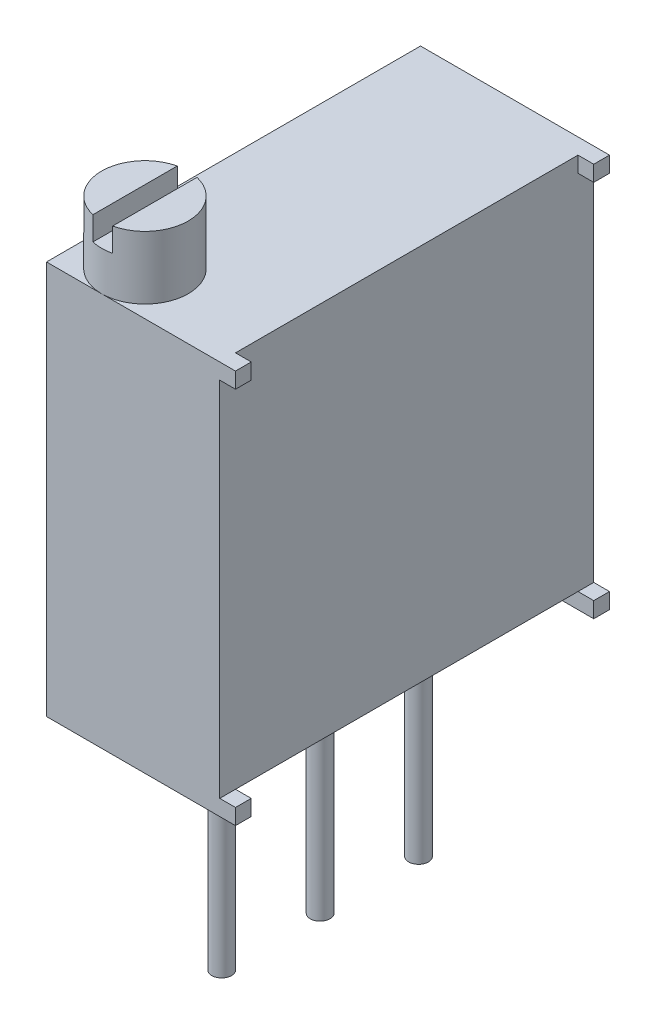
from build123d import *

# Parameters (mm, degrees)
EXTRUDE_1_DEPTH     = 4.4
SKETCH_1_4_W        = 0.4
SKETCH_1_4_H        = 0.4
EXTRUDE_2_DEPTH     = 4.8
SKETCH_2_R          = 1.1
EXTRUDE_3_DEPTH     = 1.6
CUT_EXTRUDE_START   = 1.6
SKETCH_2_5_W        = 0.5
SKETCH_2_5_H        = 2.2
CUT_EXTRUDE_2_DEPTH = 0.6
SKETCH_3_R          = 0.25
EXTRUDE_4_DEPTH     = 6


with BuildPart() as part:
    # 草图1 → 凸台-拉伸1 (new body)
    with BuildSketch(Plane(origin=(0, 0, 0), x_dir=(0, 0, -1), z_dir=(1, 0, 0))):
        Polygon((-4.75, 4.4), (-4.75, -4.8), (-4.35, -4.8), (4.35, -4.8), (4.75, -4.8), (4.75, 4.4), (4.35, 4.4), (4.35, 4.8), (-4.35, 4.8), (-4.35, 4.4), align=None)
    extrude(amount=EXTRUDE_1_DEPTH)

    # 草图1<4> → 凸台-拉伸2 (add)
    with BuildSketch(Plane(origin=(0, 0, 0), x_dir=(0, 0, -1), z_dir=(1, 0, 0))):
        with Locations((4.55, 4.6)):
            Rectangle(SKETCH_1_4_W, SKETCH_1_4_H)
        with Locations((4.55, -5)):
            Rectangle(SKETCH_1_4_W, SKETCH_1_4_H)
        with Locations((-4.55, 4.6)):
            Rectangle(SKETCH_1_4_W, SKETCH_1_4_H)
        with Locations((-4.55, -5)):
            Rectangle(SKETCH_1_4_W, SKETCH_1_4_H)
    extrude(amount=EXTRUDE_2_DEPTH)

    # 草图2 → 凸台-拉伸3 (add)
    with BuildSketch(Plane(origin=(0, 4.8, 0), x_dir=(1, 0, 0), z_dir=(0, 1, 0))):
        with Locations(Location((1.4, -3.65, 0), (0, 0, 270))):
            Circle(SKETCH_2_R)
    extrude(amount=EXTRUDE_3_DEPTH)

    # 草图2<5> → 切除-拉伸2 (cut)
    with BuildSketch(Plane(origin=(0, 4.8, 0), x_dir=(1, 0, 0), z_dir=(0, 1, 0)).offset(CUT_EXTRUDE_START)):
        with Locations((1.4, -3.65)):
            Rectangle(SKETCH_2_5_W, SKETCH_2_5_H)
    extrude(amount=-CUT_EXTRUDE_2_DEPTH, mode=Mode.SUBTRACT)

    # 草图3 → 凸台-拉伸4 (add)
    with BuildSketch(Plane.XZ.offset(4.8)):
        with Locations(Location((2.2, 0, 0), (0, 0, 90))):
            Circle(SKETCH_3_R)
        with Locations(Location((2.2, 2.5, 0), (0, 0, 90))):
            Circle(SKETCH_3_R)
        with Locations(Location((2.2, -2.5, 0), (0, 0, 90))):
            Circle(SKETCH_3_R)
    extrude(amount=EXTRUDE_4_DEPTH)


solid = part.part
